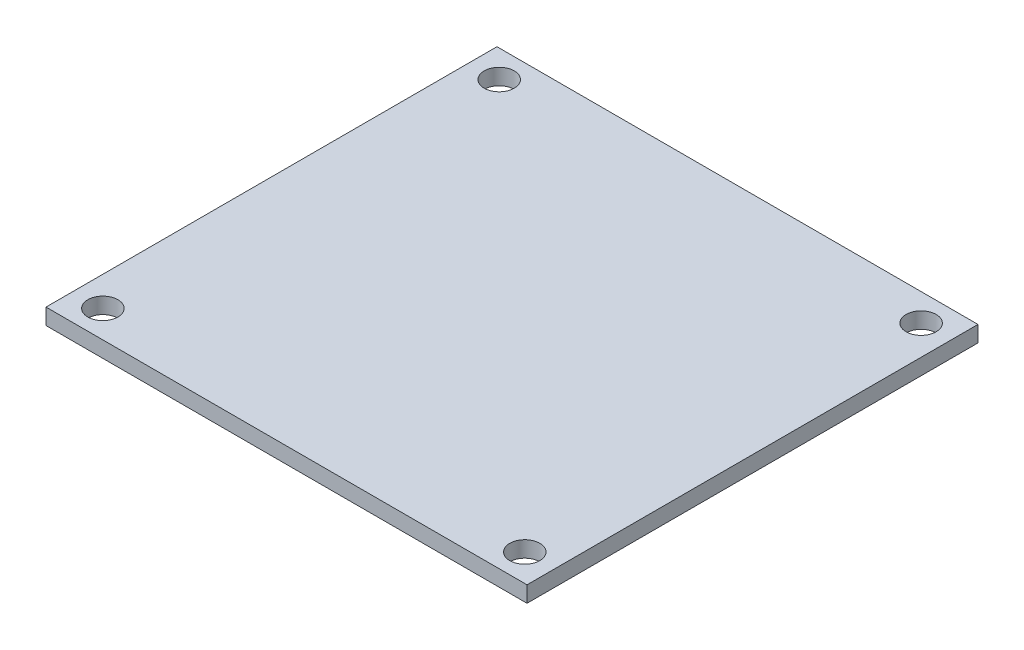
from build123d import *

# Parameters (mm, degrees)
CROQUIS1_W              = 48
CROQUIS1_H              = 45
CROQUIS1_R              = 1.5
SALIENTE_EXTRUIR1_DEPTH = 1.6


with BuildPart() as part:
    # Croquis1 → Saliente-Extruir1 (new body)
    with BuildSketch(Plane(origin=(0, 0, 0), x_dir=(1, 0, 0), z_dir=(0, 1, 0))):
        Rectangle(CROQUIS1_W, CROQUIS1_H)
        with Locations(Location((21.05, 19.775, 0), (0, 0, 270))):
            Circle(CROQUIS1_R, mode=Mode.SUBTRACT)
        with Locations(Location((-21.05, 19.775, 0), (0, 0, 270))):
            Circle(CROQUIS1_R, mode=Mode.SUBTRACT)
        with Locations(Location((-21.05, -19.775, 0), (0, 0, 270))):
            Circle(CROQUIS1_R, mode=Mode.SUBTRACT)
        with Locations(Location((21.05, -19.775, 0), (0, 0, 270))):
            Circle(CROQUIS1_R, mode=Mode.SUBTRACT)
    extrude(amount=SALIENTE_EXTRUIR1_DEPTH)


solid = part.part
